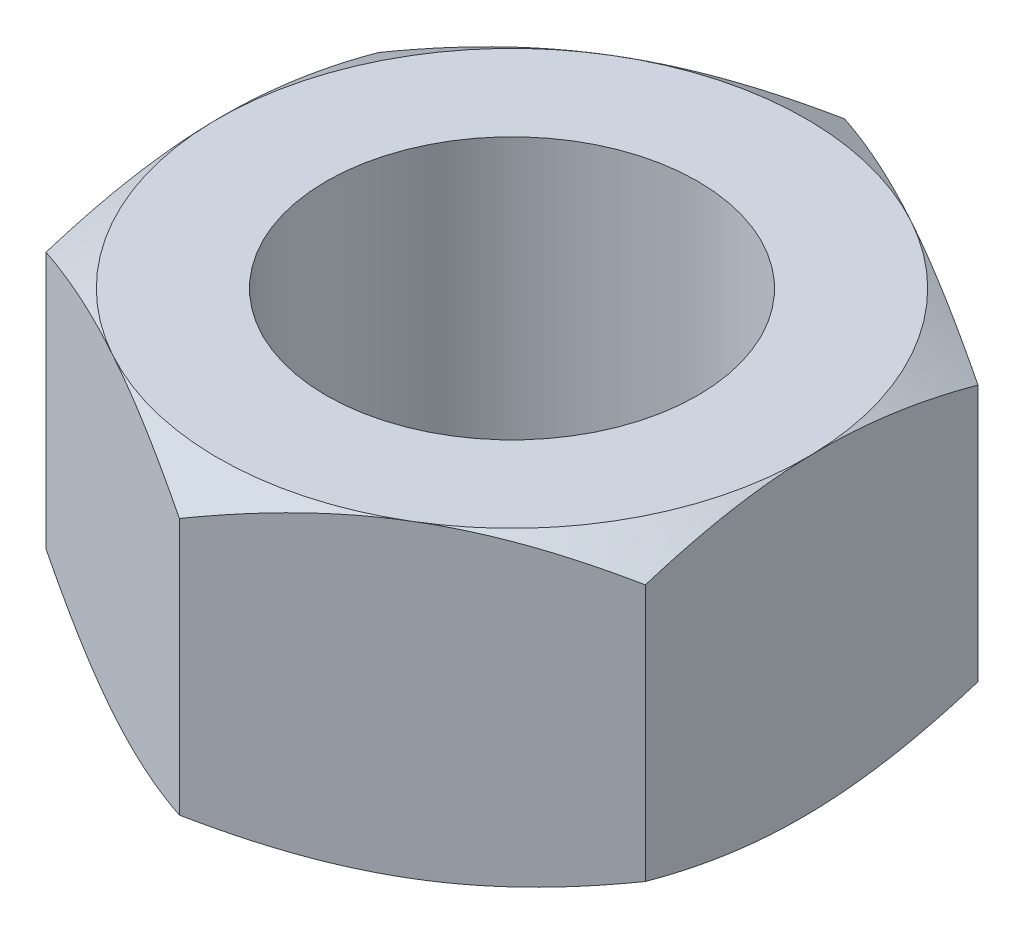
from build123d import *

# Parameters (mm, degrees)
BOSS_EXTRUDE1_DEPTH = 10
SKETCH2_R           = 6
CUT_EXTRUDE1_DEPTH  = 10
SKETCH3_OUTSIDE_W   = 68.948
SKETCH3_OUTSIDE_H   = 71.67
SKETCH3_OUTSIDE_R   = 9.5
CUT_EXTRUDE4_DEPTH  = 12
CUT_EXTRUDE4_DRAFT  = -60
SKETCH4_OUTSIDE_W   = 68.948
SKETCH4_OUTSIDE_H   = 71.67
SKETCH4_OUTSIDE_R   = 9.5
CUT_EXTRUDE5_DEPTH  = 12
CUT_EXTRUDE5_DRAFT  = -60


with BuildPart() as part:
    # Sketch1 → Boss-Extrude1 (new body)
    with BuildSketch(Plane(origin=(0, 0, 0), x_dir=(1, 0, 0), z_dir=(0, 1, 0))):
        Polygon((9.606581004, -5.295935682), (9.389705339, 5.671575352), (-0.216875665, 10.967511034), (-9.606581004, 5.295935682), (-9.389705339, -5.671575352), (0.216875665, -10.967511034), align=None)
    extrude(amount=BOSS_EXTRUDE1_DEPTH)

    # Sketch2 → Cut-Extrude1 (cut)
    with BuildSketch(Plane(origin=(0, 10, 0), x_dir=(1, 0, 0), z_dir=(0, 1, 0))):
        with Locations(Location((0, 0, 0), (0, 0, 270))):
            Circle(SKETCH2_R)
    extrude(amount=-CUT_EXTRUDE1_DEPTH, mode=Mode.SUBTRACT)


with BuildPart() as cut_extrude4_tool:
    # Sketch3 outside → Cut-Extrude4 (with draft: the straight prism first)
    with BuildSketch(Plane(origin=(0, 10, 0), x_dir=(1, 0, 0), z_dir=(0, 1, 0))):
        Rectangle(SKETCH3_OUTSIDE_W, SKETCH3_OUTSIDE_H)
        Circle(SKETCH3_OUTSIDE_R, mode=Mode.SUBTRACT)
    extrude(amount=-CUT_EXTRUDE4_DEPTH)
    # Cut-Extrude4: the draft: its side faces are tilted about the plane it starts from
    cut_extrude4_sides = [cut_extrude4_tool.faces().sort_by_distance(p)[0] for p in [
        (0, 4, 35.835),
        (34.474, 4, 0),
        (0, 4, -35.835),
        (-34.474, 4, 0),
        (-9.5, 4, 0),
    ]]
    draft(cut_extrude4_sides, Plane(origin=(0, 10, 0), x_dir=(1, 0, 0), z_dir=(0, 1, 0)), CUT_EXTRUDE4_DRAFT)


with BuildPart() as part_1:
    add(part.part)

    # Cut-Extrude4: cut by cut_extrude4_tool
    add(cut_extrude4_tool.part, mode=Mode.SUBTRACT)


with BuildPart() as cut_extrude5_tool:
    # Sketch4 outside → Cut-Extrude5 (with draft: the straight prism first)
    with BuildSketch(Plane.XZ):
        Rectangle(SKETCH4_OUTSIDE_W, SKETCH4_OUTSIDE_H)
        Circle(SKETCH4_OUTSIDE_R, mode=Mode.SUBTRACT)
    extrude(amount=-CUT_EXTRUDE5_DEPTH)
    # Cut-Extrude5: the draft: its side faces are tilted about the plane it starts from
    cut_extrude5_sides = [cut_extrude5_tool.faces().sort_by_distance(p)[0] for p in [
        (0, 6, -35.835),
        (34.474, 6, 0),
        (0, 6, 35.835),
        (-34.474, 6, 0),
        (-9.5, 6, 0),
    ]]
    draft(cut_extrude5_sides, Plane.XZ, CUT_EXTRUDE5_DRAFT)


with BuildPart() as part_2:
    add(part_1.part)

    # Cut-Extrude5: cut by cut_extrude5_tool
    add(cut_extrude5_tool.part, mode=Mode.SUBTRACT)


solid = part_2.part
